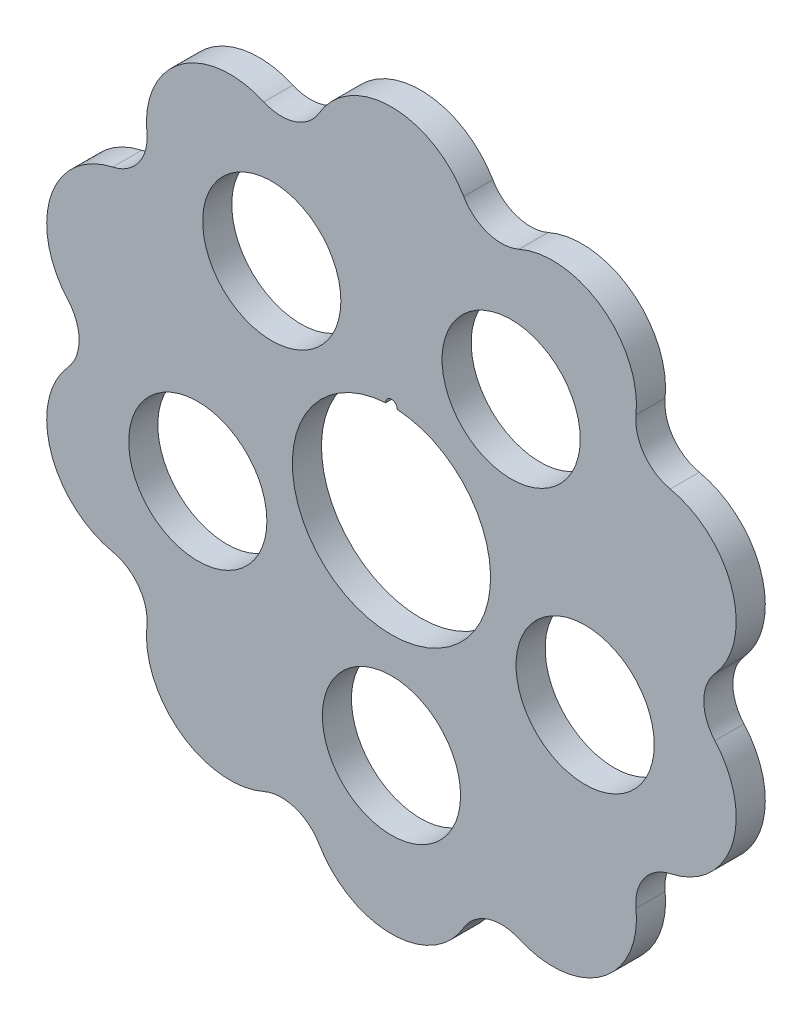
from build123d import *

# Parameters (mm, degrees)
SKETCH_1_R          = 13.625
SKETCH_1_R_2        = 9.5
EXTRUDE_1_DEPTH     = 4
SKETCH_2_R          = 0.8
CUT_EXTRUDE_1_DEPTH = 10


with BuildPart() as part:
    # 草图1 → 凸台-拉伸1 (new body)
    with BuildSketch(Plane.XY):
        with BuildLine():
            ThreePointArc((-9.939636128, -43.533911621), (0, -49.25), (9.939636128, -43.533911621))
            ThreePointArc((9.939636128, -43.533911621), (13.271431273, -40.845265542), (17.547256679, -41.062045862))
            ThreePointArc((17.547256679, -41.062045862), (28.948423675, -39.844086973), (33.629925771, -29.377302803))
            ThreePointArc((33.629925771, -29.377302803), (34.745058151, -25.243762385), (38.331693845, -22.905874232))
            ThreePointArc((38.331693845, -22.905874232), (46.839533428, -15.219086973), (44.474726808, -3.999562813))
            ThreePointArc((44.474726808, -3.999562813), (42.947253757, 0), (44.474726808, 3.999562813))
            ThreePointArc((44.474726808, 3.999562813), (46.839533428, 15.219086973), (38.331693845, 22.905874232))
            ThreePointArc((38.331693845, 22.905874232), (34.745058151, 25.243762385), (33.629925771, 29.377302803))
            ThreePointArc((33.629925771, 29.377302803), (28.948423675, 39.844086973), (17.547256679, 41.062045862))
            ThreePointArc((17.547256679, 41.062045862), (13.271431273, 40.845265542), (9.939636128, 43.533911621))
            ThreePointArc((9.939636128, 43.533911621), (0, 49.25), (-9.939636128, 43.533911621))
            ThreePointArc((-9.939636128, 43.533911621), (-13.271431273, 40.845265542), (-17.547256679, 41.062045862))
            ThreePointArc((-17.547256679, 41.062045862), (-28.948423675, 39.844086973), (-33.629925771, 29.377302803))
            ThreePointArc((-33.629925771, 29.377302803), (-34.745058151, 25.243762385), (-38.331693845, 22.905874232))
            ThreePointArc((-38.331693845, 22.905874232), (-46.839533428, 15.219086973), (-44.474726808, 3.999562813))
            ThreePointArc((-44.474726808, 3.999562813), (-42.947253757, 0), (-44.474726808, -3.999562813))
            ThreePointArc((-44.474726808, -3.999562813), (-46.839533428, -15.219086973), (-38.331693845, -22.905874232))
            ThreePointArc((-38.331693845, -22.905874232), (-34.745058151, -25.243762385), (-33.629925771, -29.377302803))
            ThreePointArc((-33.629925771, -29.377302803), (-28.948423675, -39.844086973), (-17.547256679, -41.062045862))
            ThreePointArc((-17.547256679, -41.062045862), (-13.271431273, -40.845265542), (-9.939636128, -43.533911621))
        make_face()
        Circle(SKETCH_1_R, mode=Mode.SUBTRACT)
        with Locations((0, -28)):
            Circle(SKETCH_1_R_2, mode=Mode.SUBTRACT)
        with Locations((-26.629582456, -8.652475842)):
            Circle(SKETCH_1_R_2, mode=Mode.SUBTRACT)
        with Locations((-16.457987064, 22.652475842)):
            Circle(SKETCH_1_R_2, mode=Mode.SUBTRACT)
        with Locations((16.457987064, 22.652475842)):
            Circle(SKETCH_1_R_2, mode=Mode.SUBTRACT)
        with Locations((26.629582456, -8.652475842)):
            Circle(SKETCH_1_R_2, mode=Mode.SUBTRACT)
    extrude(amount=EXTRUDE_1_DEPTH)

    # 草图2 → 切除-拉伸1 (cut)
    with BuildSketch(Plane.XY.offset(4)):
        with Locations((0, 13.625)):
            Circle(SKETCH_2_R)
    extrude(amount=-CUT_EXTRUDE_1_DEPTH, mode=Mode.SUBTRACT)


solid = part.part
